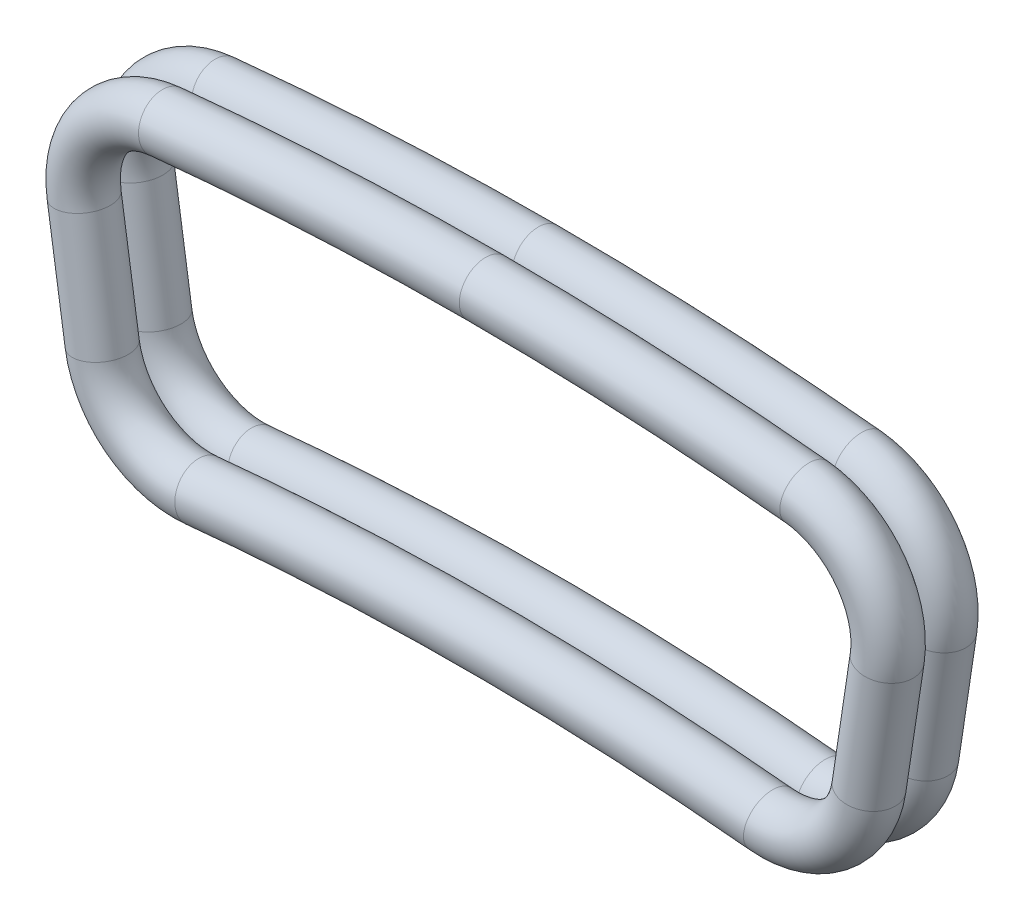
from build123d import *

# Parameters (mm, degrees)
SKETCH4_R       = 0.814
LPATTERN1_COUNT = 2
LPATTERN1_PITCH = 1.628


with BuildPart() as part:
    # Sweep2: sweep along a path in Sketch3
    with BuildLine(Plane.XY.offset(-2.386)) as sweep2_path:
        Line((11.845274932, 90.759308381), (12.403974274, 94.466036321))
        ThreePointArc((12.403974274, 94.466036321), (11.844320083, 96.610909759), (9.905288821, 97.685085092))
        ThreePointArc((9.905288821, 97.685085092), (0, 98.186), (-9.905288821, 97.685085092))
        ThreePointArc((-9.905288821, 97.685085092), (-11.844320083, 96.610909759), (-12.403974274, 94.466036321))
        Line((-12.403974274, 94.466036321), (-11.845274932, 90.759308381))
        ThreePointArc((-11.845274932, 90.759308381), (-10.79037915, 88.957511394), (-8.784379018, 88.378511423))
        ThreePointArc((-8.784379018, 88.378511423), (0, 88.814), (8.784379018, 88.378511423))
        ThreePointArc((8.784379018, 88.378511423), (10.79037915, 88.957511394), (11.845274932, 90.759308381))
    # Sketch4 → Sweep2 (sweep)
    with BuildSketch(Plane(origin=(0, 0, 0), x_dir=(0, 0, -1), z_dir=(1, 0, 0))):
        with Locations((2.386, 98.186)):
            Circle(SKETCH4_R)
    sweep(path=sweep2_path.line)


with BuildPart() as lpattern1_1:
    # LPattern1: pattern copy
    add(part.part.moved(Location(Vector(0, 0, 1) * (1 * LPATTERN1_PITCH))))


solid = Compound([part.part, lpattern1_1.part])
